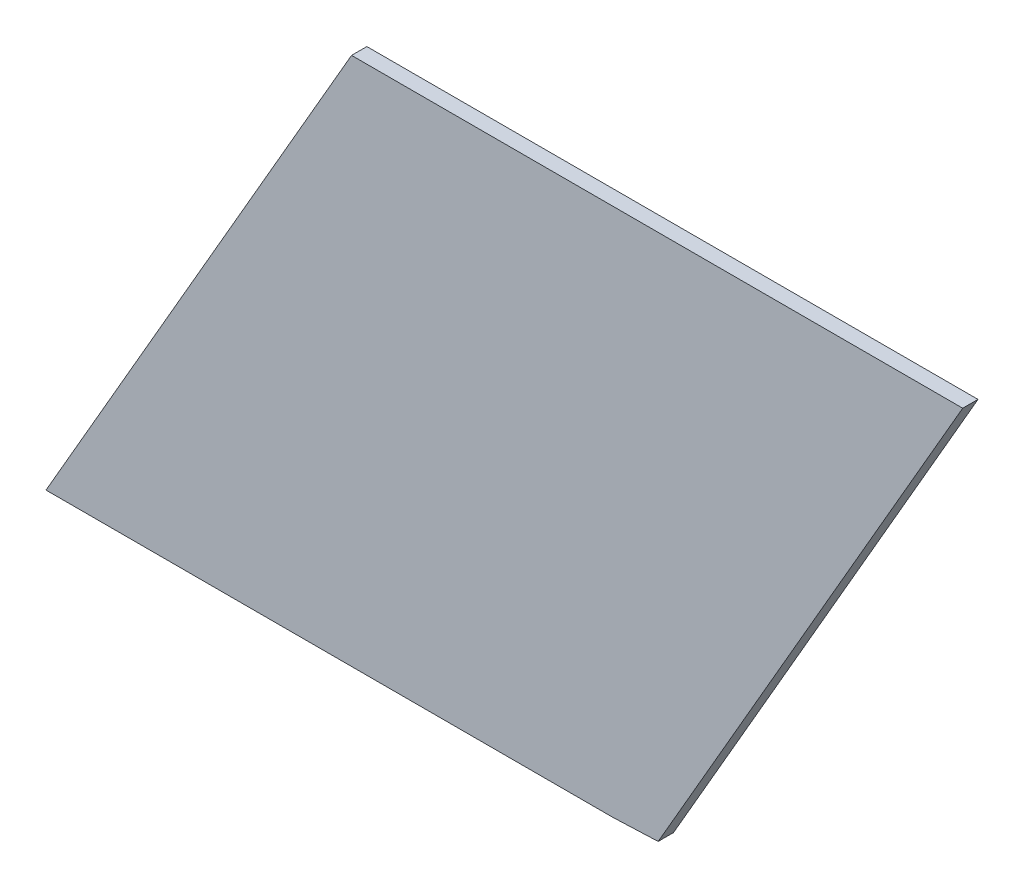
from build123d import *

# Parameters (mm, degrees)
BOSS_EXTRUDE1_DEPTH = 2


with BuildPart() as part:
    # Sketch1 → Boss-Extrude1 (new body)
    with BuildSketch(Plane.XY):
        Polygon((-328.237783231, 112.984054613), (-402.464280539, 112.984054613), (-362.464280539, 182.266086915), (-282.464280539, 182.266086915), (-322.328895982, 113.218547543), align=None)
    extrude(amount=BOSS_EXTRUDE1_DEPTH)


solid = part.part
